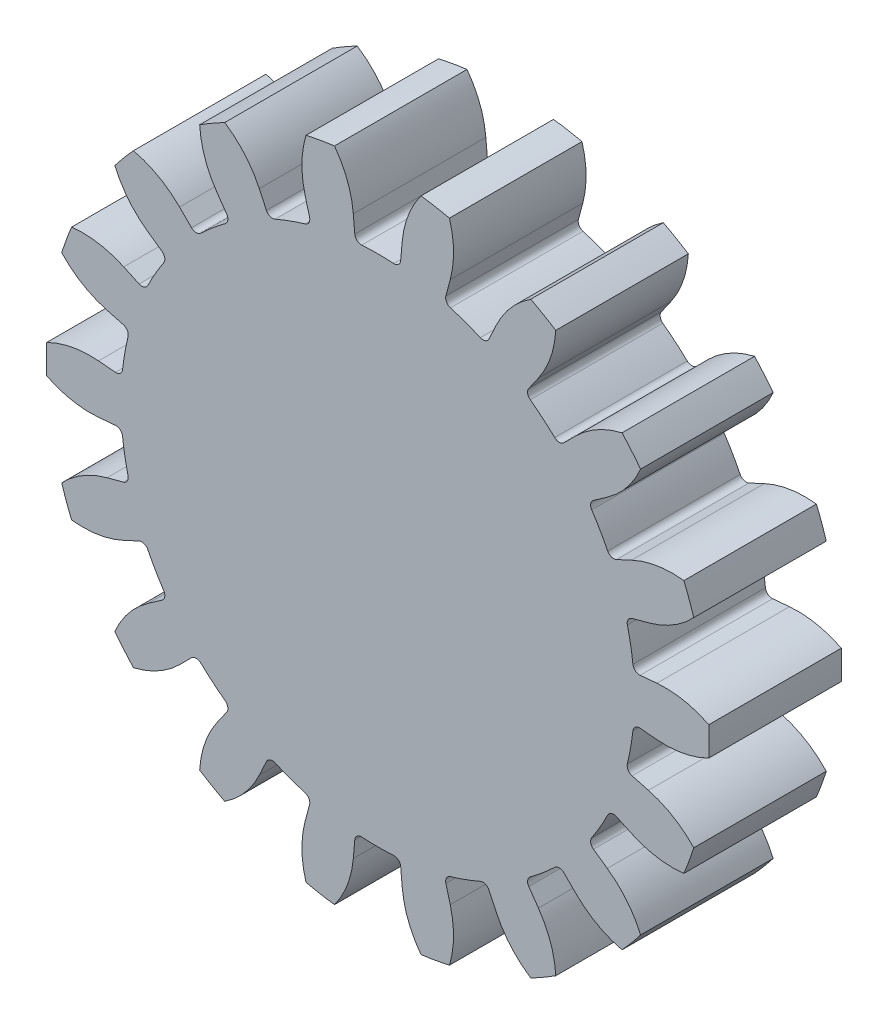
from build123d import *

# Parameters (mm, degrees)
BOSS_EXTRUDE1_DEPTH = 20
FILLET1_R           = 1
CIRPATTERN1_COUNT   = 18
FILLET2_R           = 1


with BuildPart() as part:
    # Sketch1 → Boss-Extrude1 (new body)
    with BuildSketch(Plane.XY):
        with BuildLine():
            Line((0, 0), (38.161300429, 6.728866885))
            ThreePointArc((38.161300429, 6.728866885), (38.418488378, 5.057889949), (38.602544551, 3.377285031))
            Line((38.602544551, 3.377285031), (42.124092809, 3.685380582))
            ThreePointArc((42.124092809, 3.685380582), (46.143152518, 3.4790331), (49.952411079, 2.180969368))
            ThreePointArc((49.952411079, 2.180969368), (50, 0), (49.952411079, -2.180969368))
            ThreePointArc((49.952411079, -2.180969368), (46.143152518, -3.4790331), (42.124092809, -3.685380582))
            Line((42.124092809, -3.685380582), (38.602544551, -3.377285031))
            ThreePointArc((38.602544551, -3.377285031), (38.418488378, -5.057889949), (38.161300429, -6.728866885))
            Line((38.161300429, -6.728866885), (0, 0))
        make_face()
    boss_extrude1 = extrude(amount=BOSS_EXTRUDE1_DEPTH)

    # Fillet1
    fillet1_edges = [part.edges().sort_by_distance(p)[0] for p in [
        (38.602544551, 3.377285031, 10),
        (38.602544551, -3.377285031, 10),
    ]]
    fillet(fillet1_edges, radius=FILLET1_R)

    # CirPattern1: Boss-Extrude1 ×18 about axis
    cirpattern1_axis = Axis((0, 0, 0), (0, 0, 1))
    for i in range(1, CIRPATTERN1_COUNT):
        add(boss_extrude1.rotate(cirpattern1_axis, i * 360 / CIRPATTERN1_COUNT))

    # Fillet2
    fillet2_edges = [part.edges().sort_by_distance(p)[0] for p in [
        (-38.602544551, -3.377285031, 10),
        (-37.429625769, -10.029237998, 10),
        (-35.119426748, -16.376457642, 10),
        (-31.742141716, -22.226086909, 10),
        (-27.400387771, -27.400387771, 10),
        (-22.226086909, -31.742141716, 10),
        (-16.376457642, -35.119426748, 10),
        (-10.029237998, -37.429625769, 10),
        (-3.377285031, -38.602544551, 10),
        (3.377285031, -38.602544551, 10),
        (10.029237998, -37.429625769, 10),
        (16.376457642, -35.119426748, 10),
        (22.226086909, -31.742141716, 10),
        (27.400387771, -27.400387771, 10),
        (31.742141716, -22.226086909, 10),
        (35.119426748, -16.376457642, 10),
        (37.429625769, -10.029237998, 10),
        (37.429625769, 10.029237998, 10),
        (35.119426748, 16.376457642, 10),
        (31.742141716, 22.226086909, 10),
        (27.400387771, 27.400387771, 10),
        (22.226086909, 31.742141716, 10),
        (16.376457642, 35.119426748, 10),
        (10.029237998, 37.429625769, 10),
        (3.377285031, 38.602544551, 10),
        (-3.377285031, 38.602544551, 10),
        (-10.029237998, 37.429625769, 10),
        (-16.376457642, 35.119426748, 10),
        (-22.226086909, 31.742141716, 10),
        (-27.400387771, 27.400387771, 10),
        (-31.742141716, 22.226086909, 10),
        (-35.119426748, 16.376457642, 10),
        (-37.429625769, 10.029237998, 10),
        (-38.602544551, 3.377285031, 10),
    ]]
    fillet(fillet2_edges, radius=FILLET2_R)


solid = part.part
